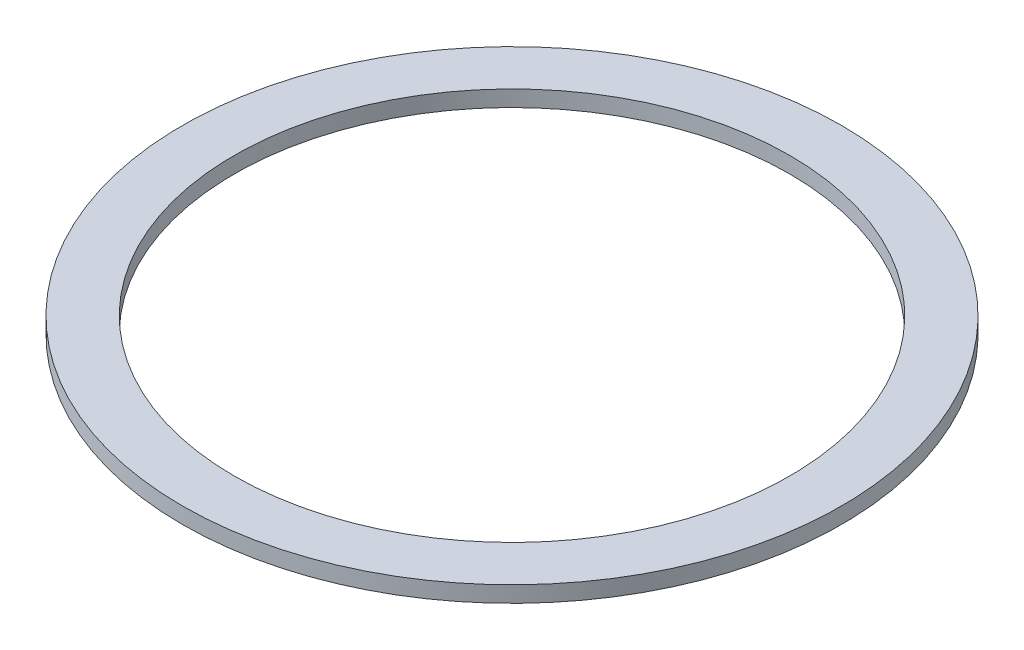
from build123d import *

# Parameters (mm, degrees)
SKETCH1_R           = 32.75
SKETCH1_R_2         = 27.6
BOSS_EXTRUDE1_DEPTH = 1.6


with BuildPart() as part:
    # Sketch1 → Boss-Extrude1 (new body)
    with BuildSketch(Plane(origin=(0, 0, 0), x_dir=(1, 0, 0), z_dir=(0, 1, 0))):
        with Locations(Location((0, 0, 0), (0, 0, 270))):
            Circle(SKETCH1_R)
        with Locations(Location((0, 0, 0), (0, 0, 270))):
            Circle(SKETCH1_R_2, mode=Mode.SUBTRACT)
    extrude(amount=BOSS_EXTRUDE1_DEPTH)


solid = part.part
